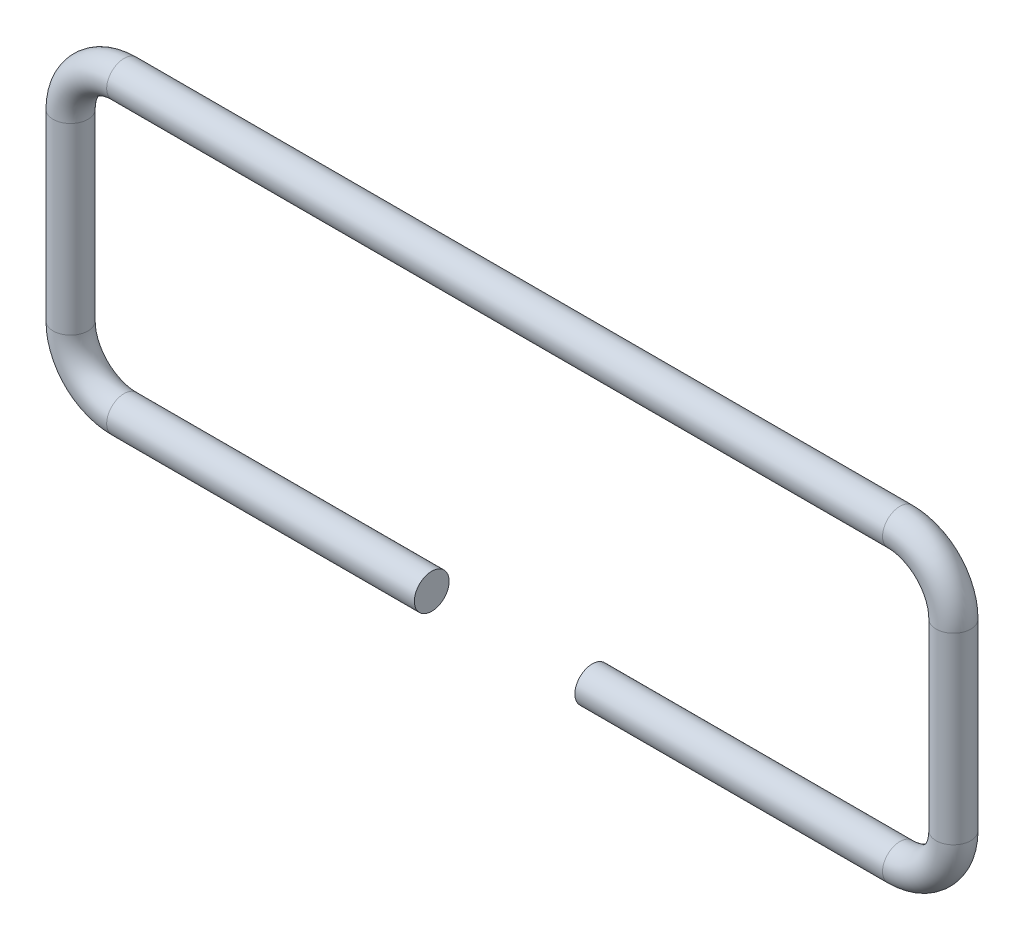
from build123d import *

# Parameters (mm, degrees)
SKETCH2_R = 0.65


with BuildPart() as part:
    # Sweep2: sweep along a path in Sketch1
    with BuildLine(Plane.XY) as sweep2_path:
        Line((-3, -5.425), (-14.5, -5.425))
        ThreePointArc((-14.5, -5.425), (-15.914213562, -4.839213562), (-16.5, -3.425))
        Line((-16.5, -3.425), (-16.5, 3.425))
        ThreePointArc((-16.5, 3.425), (-15.914213562, 4.839213562), (-14.5, 5.425))
        Line((-14.5, 5.425), (14.5, 5.425))
        ThreePointArc((14.5, 5.425), (15.914213562, 4.839213562), (16.5, 3.425))
        Line((16.5, 3.425), (16.5, -3.425))
        ThreePointArc((16.5, -3.425), (15.914213562, -4.839213562), (14.5, -5.425))
        Line((14.5, -5.425), (3, -5.425))
    # Sketch2 → Sweep2 (sweep)
    with BuildSketch(Plane(origin=(-3, 0, 0), x_dir=(0, 0, -1), z_dir=(1, 0, 0))):
        with Locations((0, -5.425)):
            Circle(SKETCH2_R)
    sweep(path=sweep2_path.line)


solid = part.part
